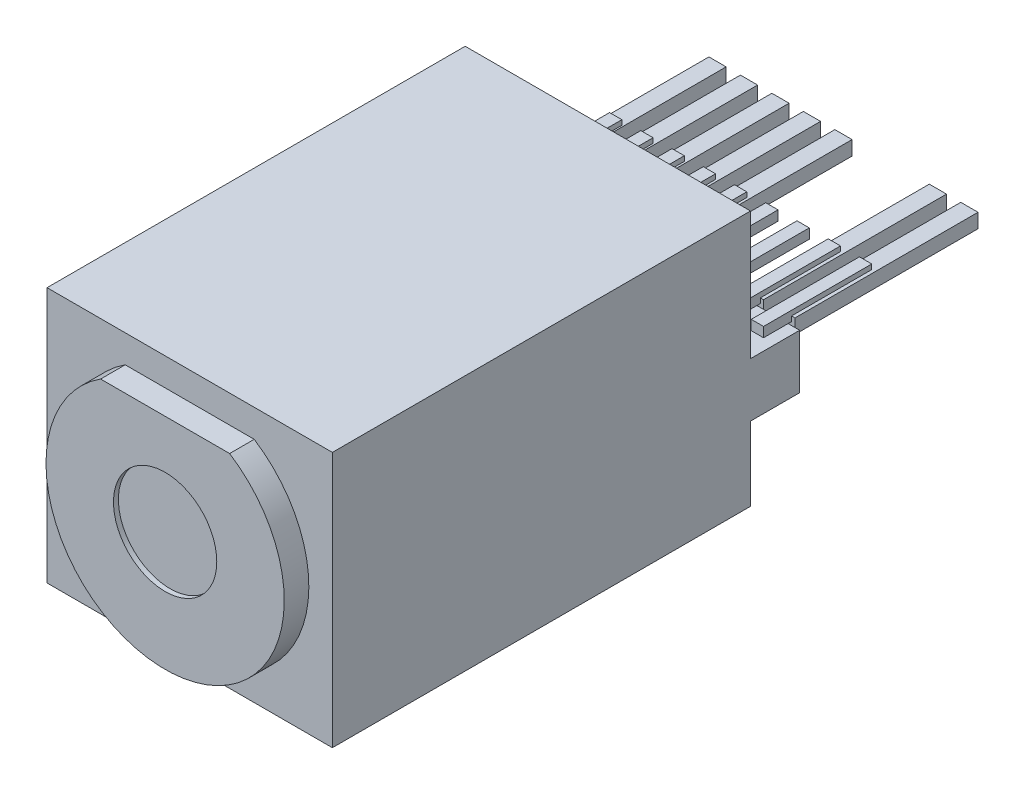
from build123d import *

# Parameters (mm, degrees)
SKETCH1_W            = 5.8
SKETCH1_H            = 5.2
BOSS_EXTRUDE1_DEPTH  = 8.5
BOSS_EXTRUDE2_DEPTH  = 0.5
SKETCH4_W            = 5.8
SKETCH4_H            = 1.1
BOSS_EXTRUDE3_DEPTH  = 1
BOSS_EXTRUDE6_START  = 0.5
SKETCH10_W           = 0.25
SKETCH10_H           = 0.2
BOSS_EXTRUDE6_DEPTH  = 2.2
BOSS_EXTRUDE7_START  = 0.07
SKETCH11_W           = 0.35
SKETCH11_H           = 0.291
BOSS_EXTRUDE7_DEPTH  = 3.72
LPATTERN3_COUNT      = 5
LPATTERN3_PITCH      = 0.635
LPATTERN3_COL_COUNT  = 5
LPATTERN3_COL_PITCH  = 0.635
LPATTERN4_COUNT      = 5
LPATTERN4_PITCH      = 0.64
LPATTERN4_COUNT_DIR2 = 5
LPATTERN4_PITCH_DIR2 = 0.64
SKETCH13_R           = 1.05
CUT_EXTRUDE1_DEPTH   = 0.1


with BuildPart() as part:
    # Sketch1 → Boss-Extrude1 (new body)
    with BuildSketch(Plane.XY):
        with Locations((2.9, 2.6)):
            Rectangle(SKETCH1_W, SKETCH1_H)
    extrude(amount=-BOSS_EXTRUDE1_DEPTH)

    # Sketch3 → Boss-Extrude2 (add)
    with BuildSketch(Plane.XY):
        with BuildLine():
            Line((1.588464453, 4.635827248), (4.211535547, 4.635827248))
            ThreePointArc((4.211535547, 4.635827248), (2.9, 0.178281999), (1.588464453, 4.635827248))
        make_face()
    extrude(amount=BOSS_EXTRUDE2_DEPTH)

    # Sketch4 → Boss-Extrude3 (add)
    with BuildSketch(Plane(origin=(0, 0, -8.5), x_dir=(-1, 0, 0), z_dir=(0, 0, -1))):
        with Locations((-2.9, 2.05)):
            Rectangle(SKETCH4_W, SKETCH4_H)
    extrude(amount=BOSS_EXTRUDE3_DEPTH)

    # Sketch10 → Boss-Extrude6 (add)
    with BuildSketch(Plane(origin=(0, 0, -8.5), x_dir=(-1, 0, 0), z_dir=(0, 0, -1)).offset(BOSS_EXTRUDE6_START)):
        with Locations((-2.9, 2.7)):
            Rectangle(SKETCH10_W, SKETCH10_H)
    boss_extrude6 = extrude(amount=BOSS_EXTRUDE6_DEPTH)

    # Sketch11 → Boss-Extrude7 (add)
    with BuildSketch(Plane(origin=(0, 0, -9.5), x_dir=(-1, 0, 0), z_dir=(0, 0, -1)).offset(BOSS_EXTRUDE7_START)):
        with Locations((-2.9, 2.5545)):
            Rectangle(SKETCH11_W, SKETCH11_H)
    boss_extrude7 = extrude(amount=BOSS_EXTRUDE7_DEPTH)

    # LPattern3: Boss-Extrude6 ×5
    with Locations(*[(-i * LPATTERN3_PITCH, 0, 0) for i in range(1, LPATTERN3_COUNT)]):
        add(boss_extrude6)

    # LPattern3 col: Boss-Extrude6 ×5
    with Locations(*[(i * LPATTERN3_COL_PITCH, 0, 0) for i in range(1, LPATTERN3_COL_COUNT)]):
        add(boss_extrude6)

    # LPattern4: Boss-Extrude7 5 × 5, 7 skipped
    with Locations(*[Vector(-1, 0, 0) * (i * LPATTERN4_PITCH) + Vector(1, 0, 0) * (j * LPATTERN4_PITCH_DIR2) for i in range(LPATTERN4_COUNT) for j in range(LPATTERN4_COUNT_DIR2) if (i, j) not in ((0, 0), (0, 1), (0, 2), (1, 2), (1, 3), (2, 3), (2, 4), (3, 4))]):
        add(boss_extrude7)

    # Sketch13 → Cut-Extrude1 (cut)
    with BuildSketch(Plane.XY.offset(0.5)):
        with Locations((2.9, 2.6)):
            Circle(SKETCH13_R)
    extrude(amount=-CUT_EXTRUDE1_DEPTH, mode=Mode.SUBTRACT)


solid = part.part
